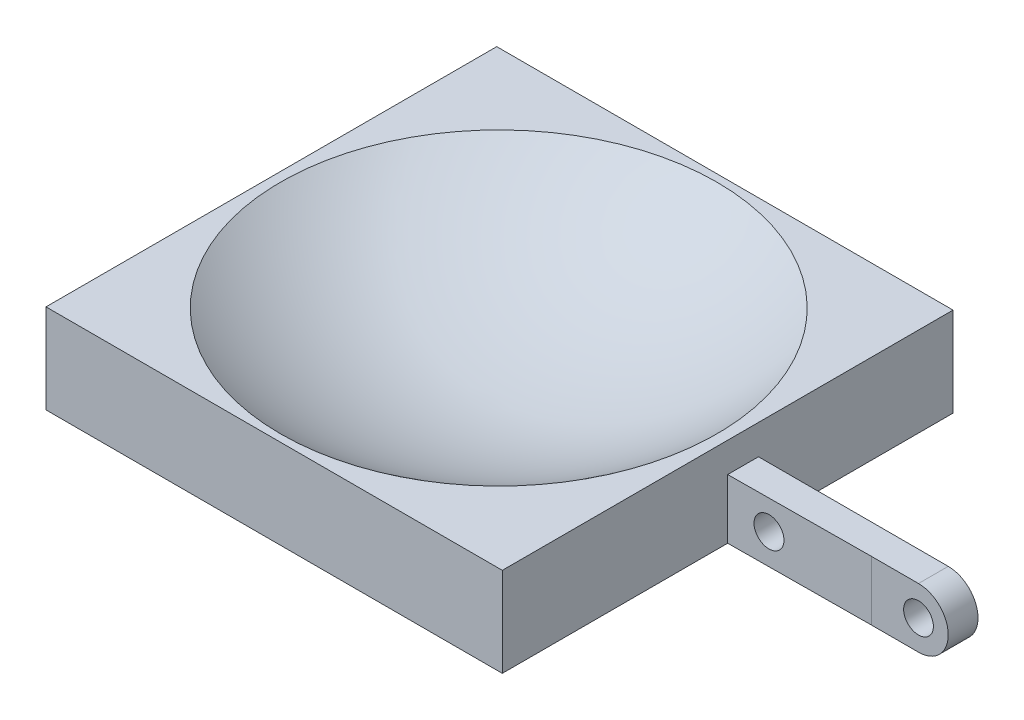
from build123d import *

# Parameters (mm, degrees)
EXTRUDE_1_DEPTH     = 10
SKETCH_2_R          = 5
CUT_EXTRUDE_1_DEPTH = 10
SKETCH_3_W          = 250
SKETCH_3_H          = 250
EXTRUDE_2_DEPTH     = 125
SKETCH_5_W          = 250
SKETCH_5_H          = 250
CUT_EXTRUDE_2_DEPTH = 95
SKETCH_8_W          = 250
SKETCH_8_H          = 250
SKETCH_8_W_2        = 153.371517144
SKETCH_8_H_2        = 151.494592983
CUT_EXTRUDE_4_DEPTH = 10
CUT_EXTRUDE_5_DEPTH = 352.385042723
SKETCH_10_R         = 5
CUT_EXTRUDE_7_DEPTH = 287.71149486
SKETCH_12_R         = 5
CUT_EXTRUDE_8_DEPTH = 287.71149486


with BuildPart() as part:
    # 草图1 → 凸台-拉伸1 (new body)
    with BuildSketch(Plane.XY):
        with BuildLine():
            Line((-217.911131847, 17.366483315), (-57.911131847, 17.366483315))
            ThreePointArc((-57.911131847, 17.366483315), (-47.911131847, 7.366483315), (-57.911131847, -2.633516685))
            Line((-57.911131847, -2.633516685), (-217.911131847, -2.633516685))
            Line((-217.911131847, -2.633516685), (-217.911131847, 17.366483315))
        make_face()
    extrude(amount=EXTRUDE_1_DEPTH)

    # 草图2 → 切除-拉伸1 (cut)
    with BuildSketch(Plane.XY.offset(10)):
        with Locations((-57.911131847, 7.366483315)):
            Circle(SKETCH_2_R)
        with Locations((-7.911347857, 7.219510907)):
            Circle(SKETCH_2_R)
    extrude(amount=-CUT_EXTRUDE_1_DEPTH, mode=Mode.SUBTRACT)

    # 草图3 → 凸台-拉伸2 (add)
    with BuildSketch(Plane.XZ.offset(2.633516685)):
        with Locations((-198.652892484, 10.352330738)):
            Rectangle(SKETCH_3_W, SKETCH_3_H)
    extrude(amount=-EXTRUDE_2_DEPTH)

    # 草图4 → 切除-旋转1 (revolve, cut)
    with BuildSketch(Plane(origin=(0, 122.366483315, 0), x_dir=(1, 0, 0), z_dir=(0, 1, 0))):
        with BuildLine():
            Line((-283.505706227, 74.500483004), (-113.800078742, -95.205144481))
            ThreePointArc((-113.800078742, -95.205144481), (-283.505706227, -95.205144481), (-283.505706227, 74.500483004))
        make_face()
    revolve(axis=Axis((-283.505706227, 122.366483315, -74.500483004), (0.7071067811865477, 0, 0.7071067811865474)), mode=Mode.SUBTRACT)

    # 草图5 → 切除-拉伸2 (cut)
    with BuildSketch(Plane(origin=(0, 122.366483315, 0), x_dir=(1, 0, 0), z_dir=(0, 1, 0))):
        with Locations((-198.652892484, -10.352330738)):
            Rectangle(SKETCH_5_W, SKETCH_5_H)
    extrude(amount=-CUT_EXTRUDE_2_DEPTH, mode=Mode.SUBTRACT)

    # 草图8 → 切除-拉伸4 (cut)
    with BuildSketch(Plane(origin=(0, 27.366483315, 0), x_dir=(1, 0, 0), z_dir=(0, 1, 0))):
        with Locations((-198.652892484, -10.352330738)):
            Rectangle(SKETCH_8_W, SKETCH_8_H)
        with Locations((-198.384057314, -10.352330739)):
            Rectangle(SKETCH_8_W_2, SKETCH_8_H_2, mode=Mode.SUBTRACT)
    extrude(amount=-CUT_EXTRUDE_4_DEPTH, mode=Mode.SUBTRACT)

    # 草图9 → 切除-拉伸5 (cut, through all)
    with BuildSketch(Plane(origin=(0, 17.366483315, 0), x_dir=(1, 0, 0), z_dir=(0, 1, 0))):
        Polygon((-275.069815886, -86.09962723), (-275.069815886, 65.394965753), (-121.698298742, 65.394965753), (-121.698298742, 0), (-73.652892484, 0), (-73.652892484, 114.647669262), (-323.652892484, 114.647669262), (-323.652892484, -135.352330738), (-73.652892484, -135.352330738), (-73.652892484, -10), (-121.698298742, -10.352330738), (-121.698298742, -86.09962723), align=None)
    extrude(amount=-CUT_EXTRUDE_5_DEPTH, mode=Mode.SUBTRACT)

    # 草图10 → 切除-拉伸7 (cut, through all)
    with BuildSketch(Plane.XY.offset(10)):
        with Locations((-107.91077949, 7.55419482)):
            Circle(SKETCH_10_R)
    extrude(amount=-CUT_EXTRUDE_7_DEPTH, mode=Mode.SUBTRACT)

    # 草图12 → 切除-拉伸8 (cut, through all)
    with BuildSketch(Plane(origin=(0, 0, 10), x_dir=(-1, 0, 0), z_dir=(0, 0, -1))):
        with Locations(Location((107.91077949, 7.55419482, 0), (0, 0, 180))):
            Circle(SKETCH_12_R)
    extrude(amount=-CUT_EXTRUDE_8_DEPTH, mode=Mode.SUBTRACT)


solid = part.part
